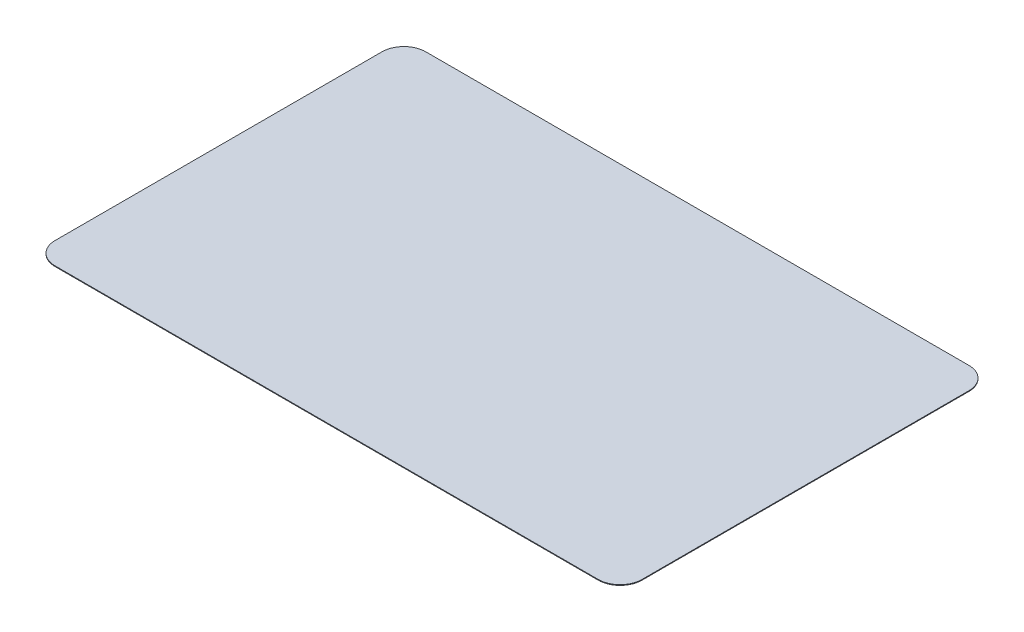
from build123d import *

# Parameters (mm, degrees)
EXTRUDE_1_DEPTH = 0.1


with BuildPart() as part:
    # 草图1 → 凸台-拉伸1 (new body)
    with BuildSketch(Plane(origin=(0, 0, 0), x_dir=(1, 0, 0), z_dir=(0, 1, 0))):
        with BuildLine():
            Line((-39.57, -27), (39.57, -27))
            ThreePointArc((39.57, -27), (41.818599564, -26.068599564), (42.75, -23.82))
            Line((42.75, -23.82), (42.75, 23.82))
            ThreePointArc((42.75, 23.82), (41.818599564, 26.068599564), (39.57, 27))
            Line((39.57, 27), (-39.57, 27))
            ThreePointArc((-39.57, 27), (-41.818599564, 26.068599564), (-42.75, 23.82))
            Line((-42.75, 23.82), (-42.75, -23.82))
            ThreePointArc((-42.75, -23.82), (-41.818599564, -26.068599564), (-39.57, -27))
        make_face()
    extrude(amount=EXTRUDE_1_DEPTH)


solid = part.part
